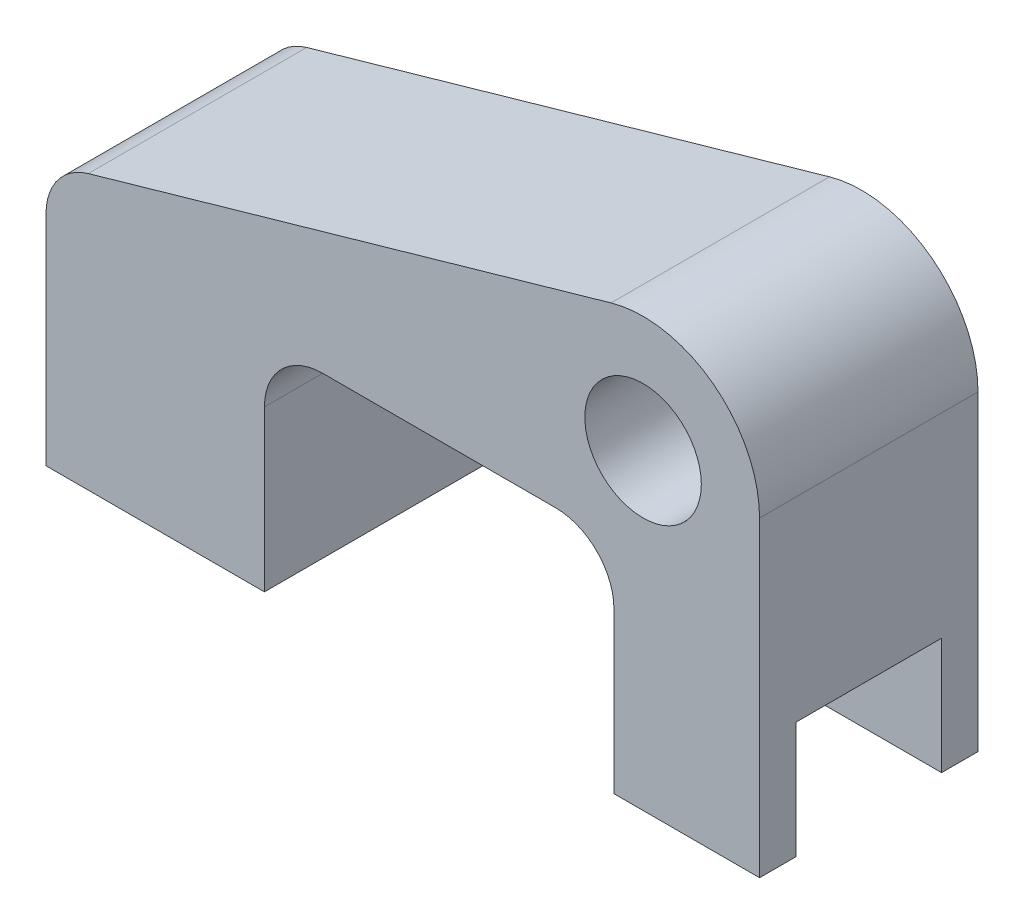
from build123d import *

# Parameters (mm, degrees)
EXTRUDE_1_DEPTH          = 15
FILLET_1_R               = 8
FILLET_2_R               = 4
SKETCH_2_R               = 4
CUT_EXTRUDE_1_DEPTH      = 46.20636026
FILLET_3_R               = 4
FILLET_4_R               = 4
SKETCH_3_R               = 1.5
CUT_EXTRUDE_2_DEPTH      = 10
CUT_EXTRUDE_3_DEPTH      = 61.351439793
CUT_EXTRUDE_3_DEPTH_BACK = 20
SKETCH_4_W               = 10
SKETCH_4_H               = 8


with BuildPart() as part:
    # 草图1 → 凸台-拉伸1 (new body)
    with BuildSketch(Plane.XY):
        Polygon((-20.674768795, 2.485242081), (-5.674768795, 2.485242081), (-5.674768795, 17.485242081), (18.325231205, 17.485242081), (18.325231205, 2.485242081), (28.325231205, 2.485242081), (28.325231205, 34.485242081), (-20.674768795, 20.485242081), align=None)
    extrude(amount=EXTRUDE_1_DEPTH)

    # 圆角1
    fillet_1_edges = [part.edges().sort_by_distance(p)[0] for p in [
        (28.325231205, 34.485242081, 7.5),
    ]]
    fillet(fillet_1_edges, radius=FILLET_1_R)

    # 圆角2
    fillet_2_edges = [part.edges().sort_by_distance(p)[0] for p in [
        (-20.674768795, 20.485242081, 7.5),
    ]]
    fillet(fillet_2_edges, radius=FILLET_2_R)

    # 草图2 → 切除-拉伸1 (cut, through all)
    with BuildSketch(Plane.XY.offset(15)):
        with Locations((20.325231205, 23.879402207)):
            Circle(SKETCH_2_R)
    extrude(amount=-CUT_EXTRUDE_1_DEPTH, mode=Mode.SUBTRACT)

    # 圆角3
    fillet_3_edges = [part.edges().sort_by_distance(p)[0] for p in [
        (-5.674768795, 17.485242081, 7.5),
    ]]
    fillet(fillet_3_edges, radius=FILLET_3_R)

    # 圆角4
    fillet_4_edges = [part.edges().sort_by_distance(p)[0] for p in [
        (18.325231205, 17.485242081, 7.5),
    ]]
    fillet(fillet_4_edges, radius=FILLET_4_R)

    # 草图3 → 切除-拉伸2 (cut)
    with BuildSketch(Plane.XZ.offset(-2.485242081)):
        with Locations(Location((-13.323141104, 7.5, 0), (0, 0, 270))):
            Circle(SKETCH_3_R)
    extrude(amount=-CUT_EXTRUDE_2_DEPTH, mode=Mode.SUBTRACT)

    # 草图4 → 切除-拉伸3 (cut, two sides: drawn at the far end of the back side and taken through both)
    with BuildSketch(Plane(origin=(28.325231205, 0, 0), x_dir=(0, 0, -1), z_dir=(1, 0, 0)).offset(-CUT_EXTRUDE_3_DEPTH_BACK)):
        with Locations((-7.5, 6.485242081)):
            Rectangle(SKETCH_4_W, SKETCH_4_H)
    extrude(amount=CUT_EXTRUDE_3_DEPTH + CUT_EXTRUDE_3_DEPTH_BACK, mode=Mode.SUBTRACT)


solid = part.part
